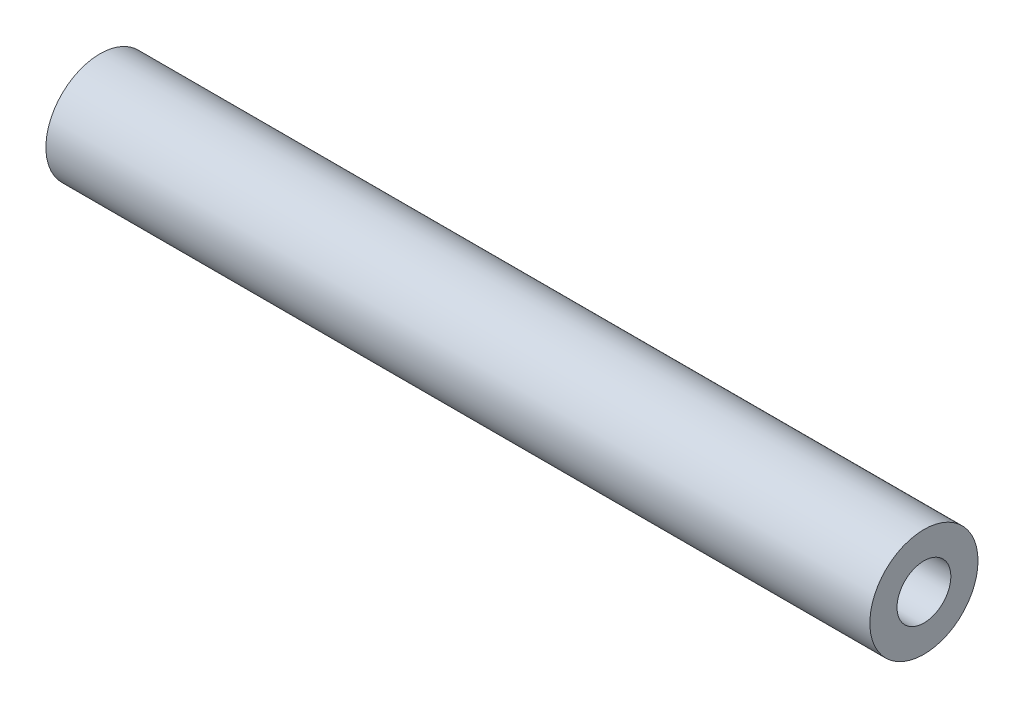
from build123d import *

# Parameters (mm, degrees)
SCHIZZO2_R                   = 2.51
SCHIZZO2_R_2                 = 1
ESTRUSIONE_ESTRUSIONE1_DEPTH = 19.125


with BuildPart() as part:
    # Schizzo2 → Estrusione-Estrusione1 (new, symmetric)
    with BuildSketch(Plane(origin=(0, 0, 0), x_dir=(0, 0, -1), z_dir=(1, 0, 0))):
        Circle(SCHIZZO2_R)
        Circle(SCHIZZO2_R_2, mode=Mode.SUBTRACT)
    extrude(amount=ESTRUSIONE_ESTRUSIONE1_DEPTH, both=True)

    # Schizzo5 → Foro filettato M3x0.5-2 (revolve, cut)
    with BuildSketch(Plane(origin=(19.125, 0, 0), x_dir=(0, 0, -1), z_dir=(0, 1, 0))):
        Polygon((0, 0), (0, 8.751075774), (1.25, 8), (1.25, 0), align=None)
    foro_filettato_m3x0_5_2 = revolve(axis=Axis((25.475, 0, 0), (-1, 0, 0)), mode=Mode.SUBTRACT)

    # Specchia1: Foro filettato M3x0.5-2 across plane
    add(foro_filettato_m3x0_5_2.mirror(Plane(origin=(0, 0, 0), x_dir=(0, 0, 1), z_dir=(1, 0, 0))), mode=Mode.SUBTRACT)


solid = part.part
